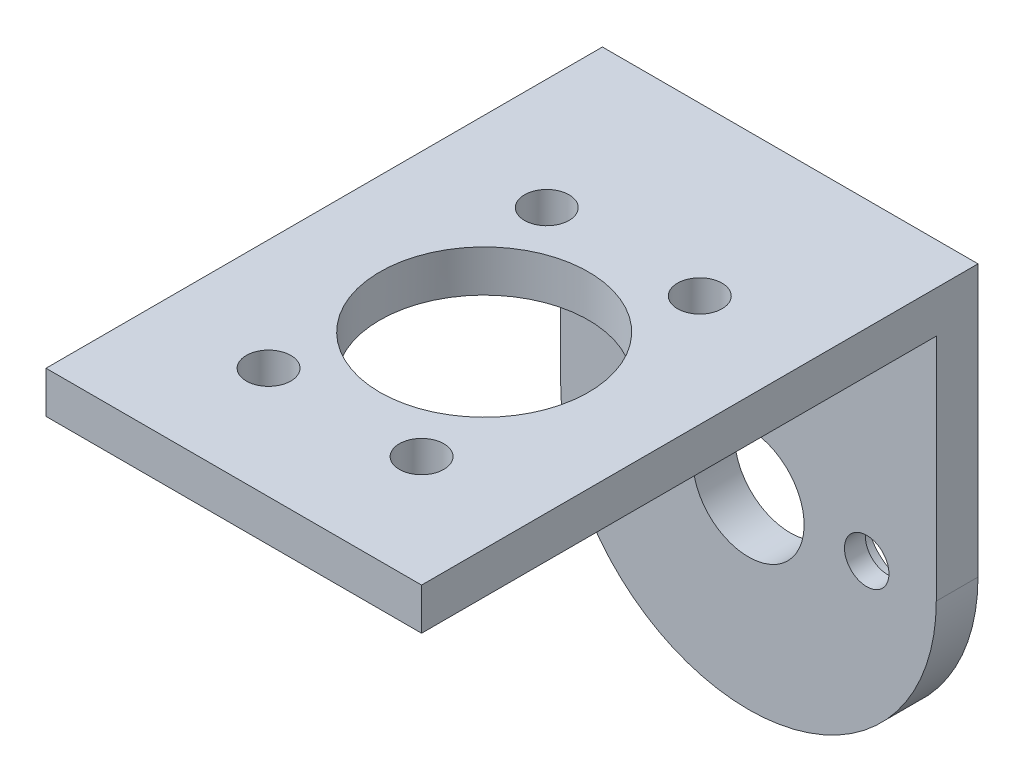
from build123d import *

# Parameters (mm, degrees)
MODEL_R             = 3.5
EXTRUDE_1_DEPTH     = 40
SKETCH_3_W          = 37
SKETCH_3_H          = 37
CUT_EXTRUDE_1_DEPTH = 40
SKETCH_4_R          = 1.5
CUT_EXTRUDE_2_DEPTH = 40
SKETCH1_R           = 4
CUT_EXTRUDE1_DEPTH  = 10
SKETCH2_R           = 1.6
CUT_EXTRUDE2_DEPTH  = 10
SKETCH3_R           = 3
CUT_EXTRUDE3_DEPTH  = 1.5
SKETCH4_R           = 1.6
CUT_EXTRUDE4_DEPTH  = 10
SKETCH5_R           = 7.5
CUT_EXTRUDE5_DEPTH  = 10


with BuildPart() as part:
    # Model → 凸台-拉伸1 (new body)
    with BuildSketch(Plane.XY):
        with BuildLine():
            Line((2619.766714505, 1592.826425633), (2619.766714505, 1612.326425633))
            Line((2619.766714505, 1612.326425633), (2592.766714505, 1612.326425633))
            Line((2592.766714505, 1612.326425633), (2592.766714505, 1592.826425633))
            ThreePointArc((2592.766714505, 1592.826425633), (2606.266714505, 1579.326425633), (2619.766714505, 1592.826425633))
        make_face()
        with Locations((2606.266714505, 1592.826425633)):
            Circle(MODEL_R, mode=Mode.SUBTRACT)
    extrude(amount=EXTRUDE_1_DEPTH)

    # 草图3 → 切除-拉伸1 (cut)
    with BuildSketch(Plane(origin=(2619.766714505, 0, 0), x_dir=(0, 0, -1), z_dir=(1, 0, 0))):
        with Locations((-21.5, 1590.826425633)):
            Rectangle(SKETCH_3_W, SKETCH_3_H)
    extrude(amount=-CUT_EXTRUDE_1_DEPTH, mode=Mode.SUBTRACT)

    # 草图4 → 切除-拉伸2 (cut)
    with BuildSketch(Plane(origin=(0, 1612.326425633, 0), x_dir=(1, 0, 0), z_dir=(0, 1, 0))):
        with Locations(Location((2600.766714505, -32, 0), (0, 0, 270))):
            Circle(SKETCH_4_R)
        with Locations(Location((2611.766714505, -32, 0), (0, 0, 270))):
            Circle(SKETCH_4_R)
        with Locations(Location((2600.766714505, -12, 0), (0, 0, 270))):
            Circle(SKETCH_4_R)
        with Locations(Location((2611.766714505, -12, 0), (0, 0, 270))):
            Circle(SKETCH_4_R)
    extrude(amount=-CUT_EXTRUDE_2_DEPTH, mode=Mode.SUBTRACT)

    # Sketch1 → Cut-Extrude1 (cut)
    with BuildSketch(Plane(origin=(0, 0, 0), x_dir=(-1, 0, 0), z_dir=(0, 0, -1))):
        with Locations((-2606.266714505, 1592.826425633)):
            Circle(SKETCH1_R)
    extrude(amount=-CUT_EXTRUDE1_DEPTH, mode=Mode.SUBTRACT)

    # Sketch2 → Cut-Extrude2 (cut)
    with BuildSketch(Plane(origin=(0, 0, 0), x_dir=(-1, 0, 0), z_dir=(0, 0, -1))):
        with Locations((-2614.766714505, 1592.826425633)):
            Circle(SKETCH2_R)
        with Locations(Location((-2597.766714505, 1592.826425633, 0), (0, 0, 90))):
            Circle(SKETCH2_R)
    extrude(amount=-CUT_EXTRUDE2_DEPTH, mode=Mode.SUBTRACT)

    # Sketch3 → Cut-Extrude3 (cut)
    with BuildSketch(Plane(origin=(0, 0, 0), x_dir=(-1, 0, 0), z_dir=(0, 0, -1))):
        with Locations((-2597.766714505, 1592.826425633)):
            Circle(SKETCH3_R)
        with Locations((-2614.766714505, 1592.826425633)):
            Circle(SKETCH3_R)
    extrude(amount=-CUT_EXTRUDE3_DEPTH, mode=Mode.SUBTRACT)

    # Sketch4 → Cut-Extrude4 (cut)
    with BuildSketch(Plane(origin=(0, 1612.326425633, 0), x_dir=(1, 0, 0), z_dir=(0, 1, 0))):
        with Locations(Location((2600.766714505, -12, 0), (0, 0, 270))):
            Circle(SKETCH4_R)
        with Locations(Location((2611.766714505, -12, 0), (0, 0, 270))):
            Circle(SKETCH4_R)
        with Locations(Location((2600.766714505, -32, 0), (0, 0, 270))):
            Circle(SKETCH4_R)
        with Locations(Location((2611.766714505, -32, 0), (0, 0, 270))):
            Circle(SKETCH4_R)
    extrude(amount=-CUT_EXTRUDE4_DEPTH, mode=Mode.SUBTRACT)

    # Sketch5 → Cut-Extrude5 (cut)
    with BuildSketch(Plane(origin=(0, 1612.326425633, 0), x_dir=(1, 0, 0), z_dir=(0, 1, 0))):
        with Locations(Location((2606.266714505, -22, 0), (0, 0, 270))):
            Circle(SKETCH5_R)
    extrude(amount=-CUT_EXTRUDE5_DEPTH, mode=Mode.SUBTRACT)


solid = part.part
